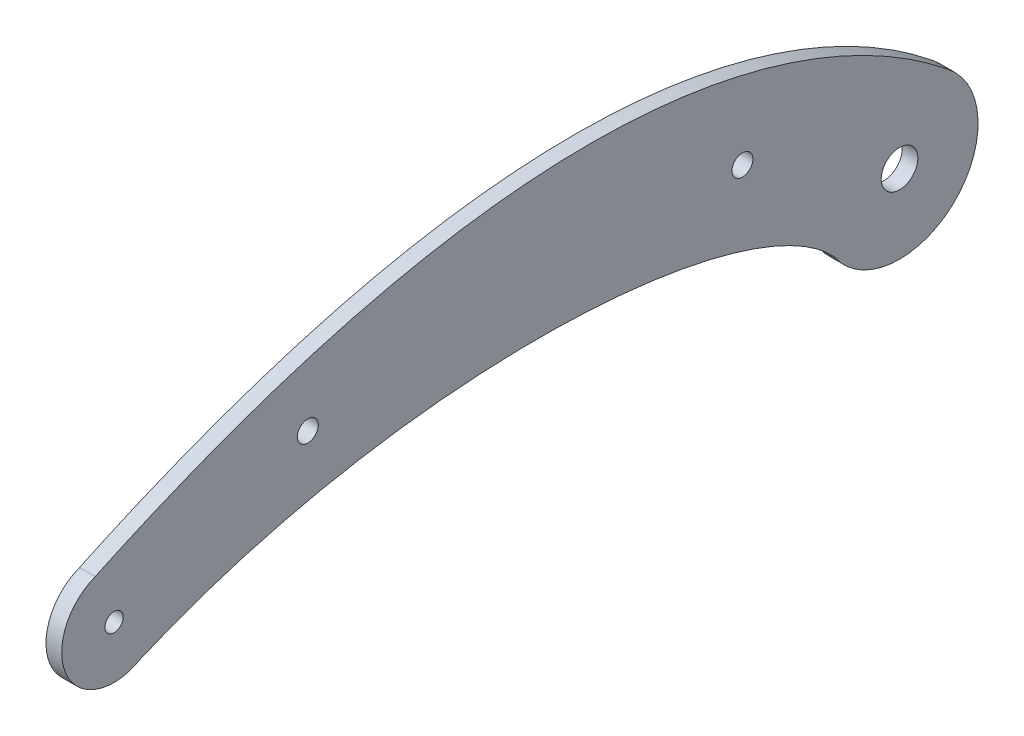
from build123d import *

# Parameters (mm, degrees)
CROQUIS1_R              = 1.75
CROQUIS1_R_2            = 3.5
CROQUIS1_R_3            = 2
SALIENTE_EXTRUIR1_DEPTH = 3


with BuildPart() as part:
    # Croquis1 → Saliente-Extruir1 (new body)
    with BuildSketch(Plane(origin=(0, 0, 0), x_dir=(0, 0, -1), z_dir=(1, 0, 0))):
        with BuildLine():
            ThreePointArc((-12.479760771, -8.321993217), (10.178991806, -11.017627957), (9.281950646, 11.783267467))
            add(Edge.make_bspline(
                [(-153.589400871, 9.333606023), (-52.027464553, 57.017454048), (-3.028685523, 21.666117386), (9.281950646, 11.783267467)],
                knots=[0, 0, 0, 0, 1, 1, 1, 1], degree=3))
            ThreePointArc((-153.589400871, 9.333606023), (-158.998047864, -4.362927301), (-144.894564169, -8.598518767))
            add(Edge.make_bspline(
                [(-144.894564169, -8.598518767), (-94.399563679, 13.089335746), (-29.021790265, 9.608207487), (-12.479760771, -8.321993217)],
                knots=[0, 0, 0, 0, 1, 1, 1, 1], degree=3))
        make_face()
        with Locations((-150, 0)):
            Circle(CROQUIS1_R, mode=Mode.SUBTRACT)
        Circle(CROQUIS1_R_2, mode=Mode.SUBTRACT)
        with Locations((-113, 13.11718)):
            Circle(CROQUIS1_R_3, mode=Mode.SUBTRACT)
        with Locations((-30, 15.614781046)):
            Circle(CROQUIS1_R_3, mode=Mode.SUBTRACT)
    extrude(amount=SALIENTE_EXTRUIR1_DEPTH)


solid = part.part
